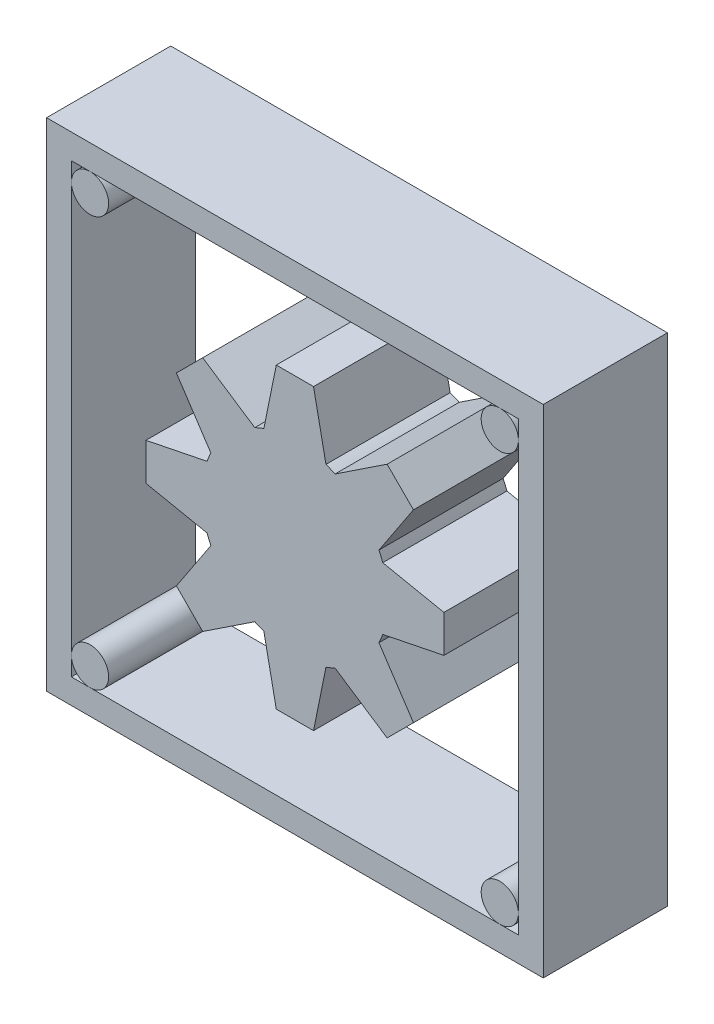
from build123d import *

# Parameters (mm, degrees)
BOSS_EXTRUDE1_DEPTH   = 10
SKETCH1_W             = 40
SKETCH1_H             = 40
SKETCH1_W_2           = 36
SKETCH1_H_2           = 36
BOSS_EXTRUDE1_2_DEPTH = 10
SKETCH2_R             = 1.5
BOSS_EXTRUDE2_DEPTH   = 10
BOSS_EXTRUDE2_2_DEPTH = 10
BOSS_EXTRUDE2_3_DEPTH = 10
BOSS_EXTRUDE2_4_DEPTH = 10


with BuildPart() as part:
    # Sketch1 → Boss-Extrude1 (new body)
    with BuildSketch(Plane.XY):
        with BuildLine():
            Line((-2.5, 7.071067812), (-1.5, 12))
            Line((-1.5, 12), (1.5, 12))
            Line((1.5, 12), (2.5, 7.071067812))
            ThreePointArc((2.5, 7.071067812), (2.870125743, 6.929096494), (3.232233047, 6.767766953))
            Line((3.232233047, 6.767766953), (7.424621202, 9.545941546))
            Line((7.424621202, 9.545941546), (9.545941546, 7.424621202))
            Line((9.545941546, 7.424621202), (6.767766953, 3.232233047))
            ThreePointArc((6.767766953, 3.232233047), (6.929096494, 2.870125743), (7.071067812, 2.5))
            Line((7.071067812, 2.5), (12, 1.5))
            Line((12, 1.5), (12, -1.5))
            Line((12, -1.5), (7.071067812, -2.5))
            ThreePointArc((7.071067812, -2.5), (6.929096494, -2.870125743), (6.767766953, -3.232233047))
            Line((6.767766953, -3.232233047), (9.545941546, -7.424621202))
            Line((9.545941546, -7.424621202), (7.424621202, -9.545941546))
            Line((7.424621202, -9.545941546), (3.232233047, -6.767766953))
            ThreePointArc((3.232233047, -6.767766953), (2.870125743, -6.929096494), (2.5, -7.071067812))
            Line((2.5, -7.071067812), (1.5, -12))
            Line((1.5, -12), (-1.5, -12))
            Line((-1.5, -12), (-2.5, -7.071067812))
            ThreePointArc((-2.5, -7.071067812), (-2.870125743, -6.929096494), (-3.232233047, -6.767766953))
            Line((-3.232233047, -6.767766953), (-7.424621202, -9.545941546))
            Line((-7.424621202, -9.545941546), (-9.545941546, -7.424621202))
            Line((-9.545941546, -7.424621202), (-6.767766953, -3.232233047))
            ThreePointArc((-6.767766953, -3.232233047), (-6.929096494, -2.870125743), (-7.071067812, -2.5))
            Line((-7.071067812, -2.5), (-12, -1.5))
            Line((-12, -1.5), (-12, 1.5))
            Line((-12, 1.5), (-7.071067812, 2.5))
            ThreePointArc((-7.071067812, 2.5), (-6.929096494, 2.870125743), (-6.767766953, 3.232233047))
            Line((-6.767766953, 3.232233047), (-9.545941546, 7.424621202))
            Line((-9.545941546, 7.424621202), (-7.424621202, 9.545941546))
            Line((-7.424621202, 9.545941546), (-3.232233047, 6.767766953))
            ThreePointArc((-3.232233047, 6.767766953), (-2.870125743, 6.929096494), (-2.5, 7.071067812))
        make_face()
    extrude(amount=BOSS_EXTRUDE1_DEPTH)


with BuildPart() as body_2:
    # Sketch1 → Boss-Extrude1 2 (new body)
    with BuildSketch(Plane.XY):
        Rectangle(SKETCH1_W, SKETCH1_H)
        Rectangle(SKETCH1_W_2, SKETCH1_H_2, mode=Mode.SUBTRACT)
    extrude(amount=BOSS_EXTRUDE1_2_DEPTH)


with BuildPart() as body_3:
    # Sketch2 → Boss-Extrude2 (new body)
    with BuildSketch(Plane.XY.offset(10)):
        with Locations((-16.5, 16.5)):
            Circle(SKETCH2_R)
    extrude(amount=-BOSS_EXTRUDE2_DEPTH)


with BuildPart() as body_4:
    # Sketch2 → Boss-Extrude2 2 (new body)
    with BuildSketch(Plane.XY.offset(10)):
        with Locations((16.5, 16.5)):
            Circle(SKETCH2_R)
    extrude(amount=-BOSS_EXTRUDE2_2_DEPTH)


with BuildPart() as body_5:
    # Sketch2 → Boss-Extrude2 3 (new body)
    with BuildSketch(Plane.XY.offset(10)):
        with Locations((16.5, -16.5)):
            Circle(SKETCH2_R)
    extrude(amount=-BOSS_EXTRUDE2_3_DEPTH)


with BuildPart() as body_6:
    # Sketch2 → Boss-Extrude2 4 (new body)
    with BuildSketch(Plane.XY.offset(10)):
        with Locations((-16.5, -16.5)):
            Circle(SKETCH2_R)
    extrude(amount=-BOSS_EXTRUDE2_4_DEPTH)


solid = Compound([part.part, body_2.part, body_3.part, body_4.part, body_5.part, body_6.part])
